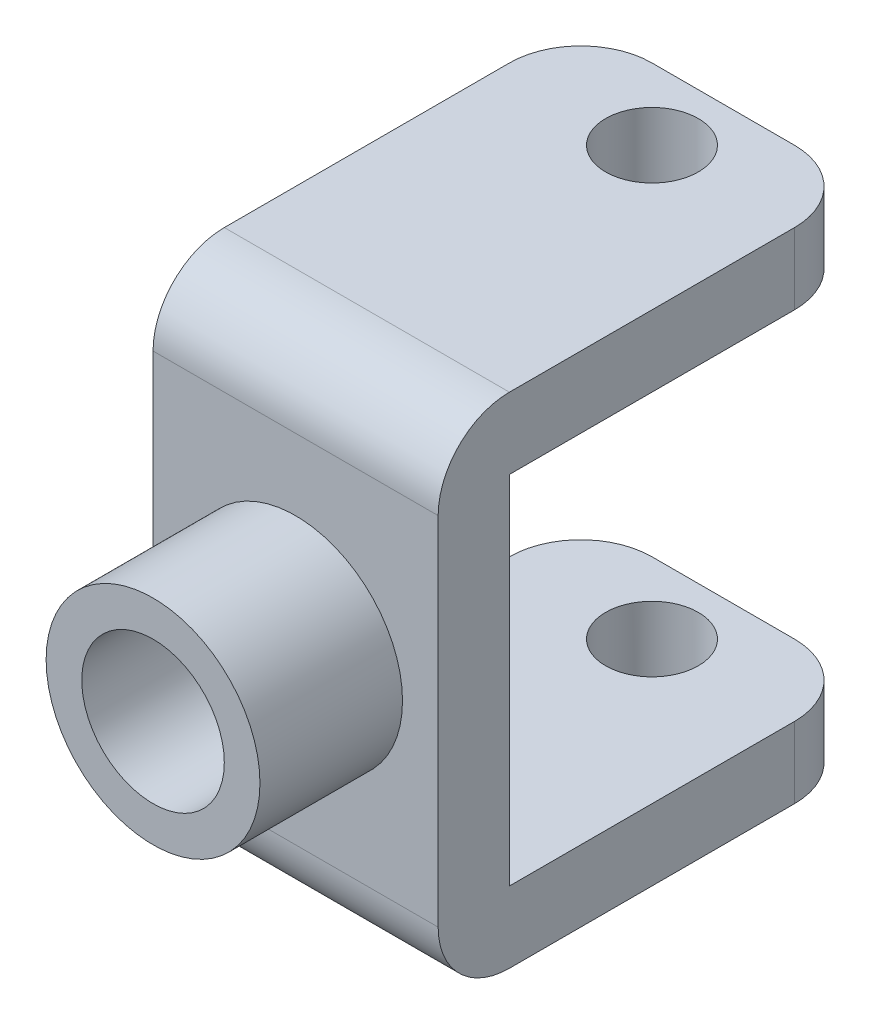
from build123d import *

# Parameters (mm, degrees)
SKETCH1_W           = 40
SKETCH1_H           = 50
BOSS_EXTRUDE1_DEPTH = 10
SKETCH2_W           = 60
SKETCH2_H           = 10
BOSS_EXTRUDE2_DEPTH = 20
FILLET1_R           = 10
SKETCH3_R           = 15
SKETCH3_R_2         = 10
BOSS_EXTRUDE3_DEPTH = 20
SKETCH4_R           = 6.5
CUT_EXTRUDE1_DEPTH  = 89.317608663


with BuildPart() as part:
    # Sketch1 → Boss-Extrude1 (new body)
    with BuildSketch(Plane.XY):
        Rectangle(SKETCH1_W, SKETCH1_H)
    extrude(amount=BOSS_EXTRUDE1_DEPTH)

    # Sketch2 → Boss-Extrude2 (add, symmetric)
    with BuildSketch(Plane(origin=(0, 0, 0), x_dir=(0, 0, -1), z_dir=(1, 0, 0))):
        with Locations((20, 30)):
            Rectangle(SKETCH2_W, SKETCH2_H)
        with Locations((20, -30)):
            Rectangle(SKETCH2_W, SKETCH2_H)
    extrude(amount=BOSS_EXTRUDE2_DEPTH, both=True)

    # Fillet1
    fillet1_edges = [part.edges().sort_by_distance(p)[0] for p in [
        (0, 35, 10),
        (-20, 30, -50),
        (20, 30, -50),
        (0, -35, 10),
        (-20, -30, -50),
        (20, -30, -50),
    ]]
    fillet(fillet1_edges, radius=FILLET1_R)

    # Sketch3 → Boss-Extrude3 (add)
    with BuildSketch(Plane.XY.offset(10)):
        with Locations(Location((0, 0, 0), (0, 0, 180))):
            Circle(SKETCH3_R)
        Circle(SKETCH3_R_2, mode=Mode.SUBTRACT)
    extrude(amount=BOSS_EXTRUDE3_DEPTH)

    # Sketch4 → Cut-Extrude1 (cut, through all)
    with BuildSketch(Plane(origin=(0, 35, 0), x_dir=(1, 0, 0), z_dir=(0, 1, 0))):
        with Locations(Location((0, 40, 0), (0, 0, 270))):
            Circle(SKETCH4_R)
    extrude(amount=-CUT_EXTRUDE1_DEPTH, mode=Mode.SUBTRACT)


solid = part.part
